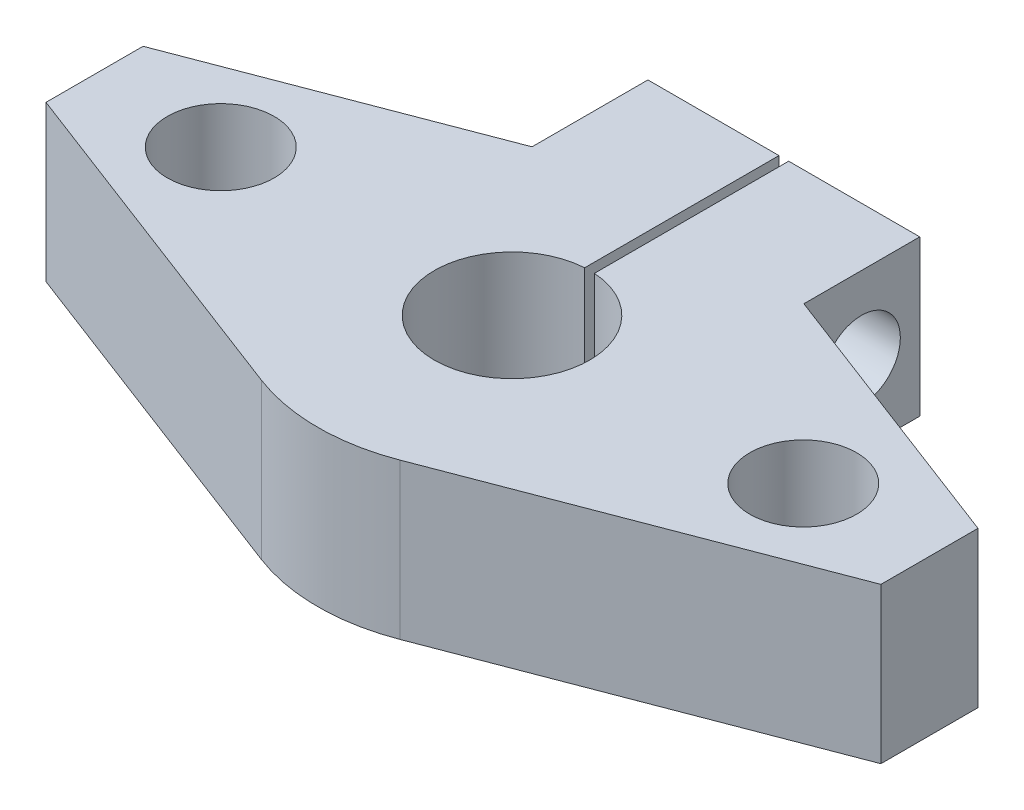
from build123d import *

# Parameters (mm, degrees)
SKETCH1_R             = 2.75
BOSS_EXTRUDE1_DEPTH   = 8
CROQUIS1_R            = 4
CORTAR_EXTRUIR1_DEPTH = 27.874709301
CROQUIS2_W            = 0.5
CROQUIS2_H            = 20
CORTAR_EXTRUIR2_DEPTH = 27.874709301
SKETCH3_R             = 2
CUT_EXTRUDE1_DEPTH    = 33.74522866


with BuildPart() as part:
    # Sketch1 → Boss-Extrude1 (new body)
    with BuildSketch(Plane(origin=(0, 0, 0), x_dir=(1, 0, 0), z_dir=(0, 1, 0))):
        with BuildLine():
            Line((0, 14), (0, -10))
            ThreePointArc((0, -10), (-1.812396329, -9.834389638), (-3.564762336, -9.343043909))
            Line((-3.564762336, -9.343043909), (-21.5, -2.5))
            Line((-21.5, -2.5), (-21.5, 2.5))
            Line((-21.5, 2.5), (-7, 8.032356947))
            Line((-7, 8.032356947), (-7, 14))
            Line((-7, 14), (0, 14))
        make_face()
        with Locations(Location((-15, 0, 0), (0, 0, 270))):
            Circle(SKETCH1_R, mode=Mode.SUBTRACT)
    boss_extrude1 = extrude(amount=BOSS_EXTRUDE1_DEPTH)

    # Simetría1: Boss-Extrude1 across plane
    add(boss_extrude1.mirror(Plane(origin=(0, 8, -14), x_dir=(0, 0, 1), z_dir=(-1, 0, 0))))

    # Croquis1 → Cortar-Extruir1 (cut, through all)
    with BuildSketch(Plane(origin=(0, 0, 0), x_dir=(1, 0, 0), z_dir=(0, 1, 0))):
        with Locations(Location((0, 0, 0), (0, 0, 270))):
            Circle(CROQUIS1_R)
    extrude(amount=CORTAR_EXTRUIR1_DEPTH, mode=Mode.SUBTRACT)

    # Croquis2 → Cortar-Extruir2 (cut, through all)
    with BuildSketch(Plane(origin=(0, 0, 0), x_dir=(1, 0, 0), z_dir=(0, 1, 0))):
        with Locations((0, 10)):
            Rectangle(CROQUIS2_W, CROQUIS2_H)
    extrude(amount=CORTAR_EXTRUIR2_DEPTH, mode=Mode.SUBTRACT)

    # Sketch3 → Cut-Extrude1 (cut, through all)
    with BuildSketch(Plane(origin=(7, 0, 0), x_dir=(0, 0, -1), z_dir=(1, 0, 0))):
        with Locations((11, 4)):
            Circle(SKETCH3_R)
    extrude(amount=-CUT_EXTRUDE1_DEPTH, mode=Mode.SUBTRACT)


solid = part.part
